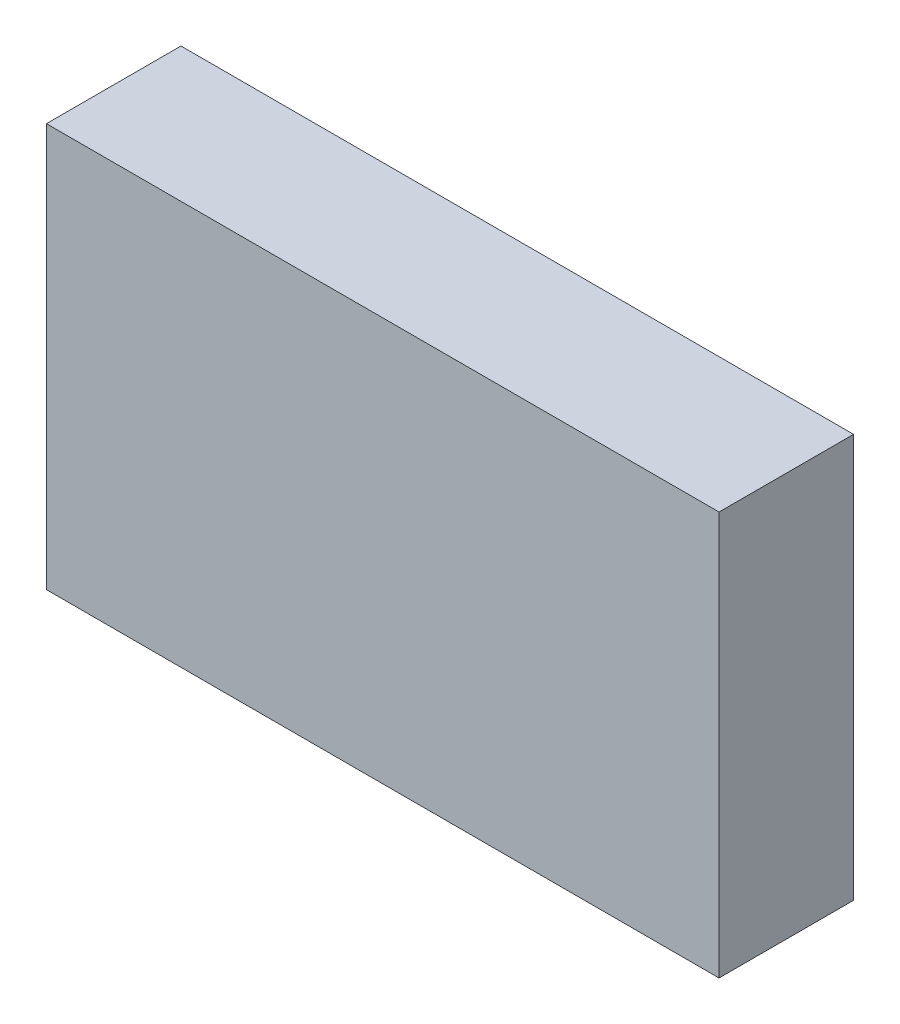
from build123d import *

# Parameters (mm, degrees)
SKETCH_1_W      = 5
SKETCH_1_H      = 3
EXTRUDE_1_DEPTH = 1


with BuildPart() as part:
    # Эскиз1 → Бобышка-Вытянуть1 (new body)
    with BuildSketch(Plane.XY):
        Rectangle(SKETCH_1_W, SKETCH_1_H)
    extrude(amount=EXTRUDE_1_DEPTH)


solid = part.part
